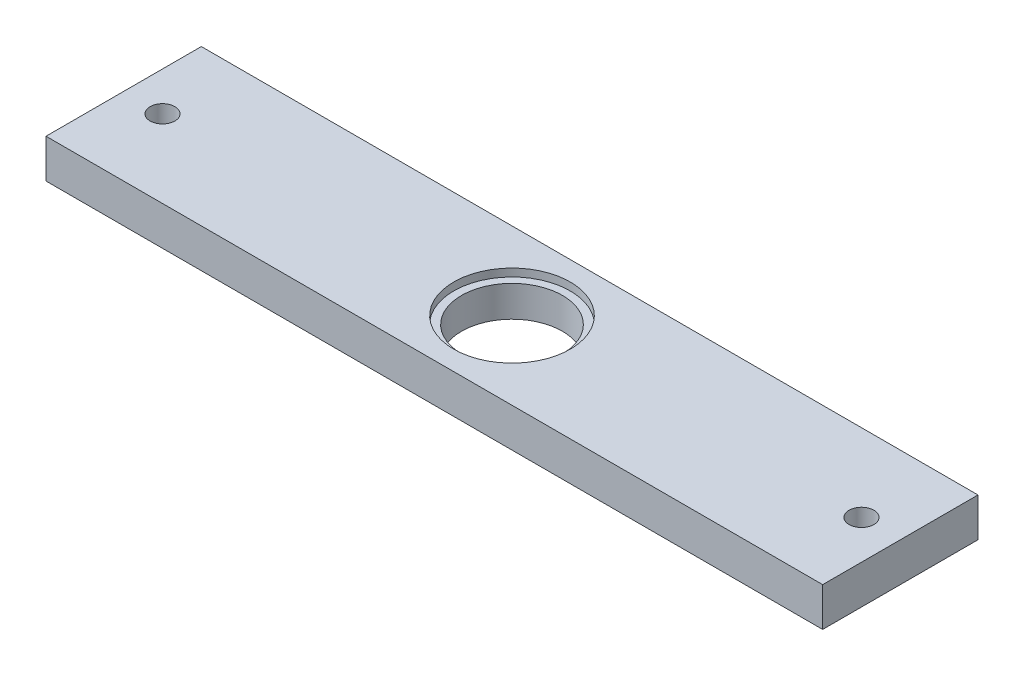
from build123d import *

# Parameters (mm, degrees)
SKETCH_1_W          = 100
SKETCH_1_H          = 20
SKETCH_1_R          = 1.6
SKETCH_1_R_2        = 6.5
EXTRUDE_1_DEPTH     = 5
SKETCH_2_R          = 7.5
CUT_EXTRUDE_1_DEPTH = 1


with BuildPart() as part:
    # 草图1 → 凸台-拉伸1 (new body)
    with BuildSketch(Plane(origin=(0, 0, 0), x_dir=(1, 0, 0), z_dir=(0, 1, 0))):
        Rectangle(SKETCH_1_W, SKETCH_1_H)
        with Locations(Location((45, 0, 0), (0, 0, 270))):
            Circle(SKETCH_1_R, mode=Mode.SUBTRACT)
        with Locations(Location((-45, 0, 0), (0, 0, 270))):
            Circle(SKETCH_1_R, mode=Mode.SUBTRACT)
        with Locations(Location((0, 0, 0), (0, 0, 270))):
            Circle(SKETCH_1_R_2, mode=Mode.SUBTRACT)
    extrude(amount=EXTRUDE_1_DEPTH)

    # 草图2 → 切除-拉伸1 (cut)
    with BuildSketch(Plane(origin=(0, 5, 0), x_dir=(1, 0, 0), z_dir=(0, 1, 0))):
        with Locations(Location((0, 0, 0), (0, 0, 270))):
            Circle(SKETCH_2_R)
    extrude(amount=-CUT_EXTRUDE_1_DEPTH, mode=Mode.SUBTRACT)


solid = part.part
